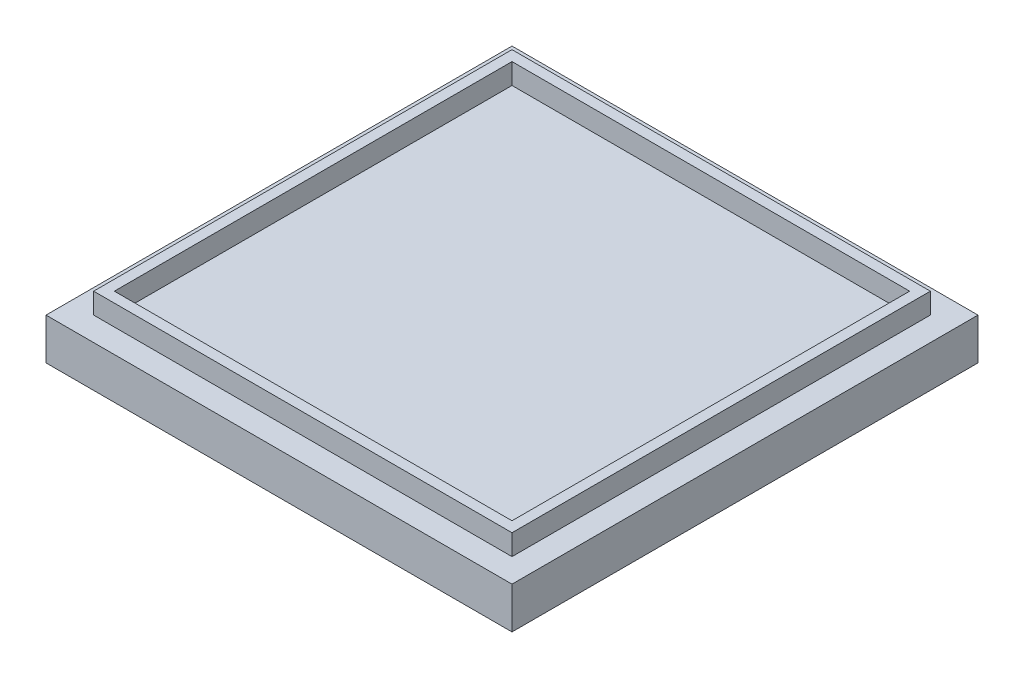
from build123d import *

# Parameters (mm, degrees)
SKETCH1_W           = 225
SKETCH1_H           = 225
BOSS_EXTRUDE1_DEPTH = 20
SKETCH2_W           = 202
SKETCH2_H           = 202
SKETCH2_W_2         = 192
SKETCH2_H_2         = 192
BOSS_EXTRUDE2_DEPTH = 10


with BuildPart() as part:
    # Sketch1 → Boss-Extrude1 (new body)
    with BuildSketch(Plane(origin=(0, 0, 0), x_dir=(1, 0, 0), z_dir=(0, 1, 0))):
        Rectangle(SKETCH1_W, SKETCH1_H)
    extrude(amount=BOSS_EXTRUDE1_DEPTH)

    # Sketch2 → Boss-Extrude2 (add)
    with BuildSketch(Plane(origin=(0, 20, 0), x_dir=(1, 0, 0), z_dir=(0, 1, 0))):
        Rectangle(SKETCH2_W, SKETCH2_H)
        Rectangle(SKETCH2_W_2, SKETCH2_H_2, mode=Mode.SUBTRACT)
    extrude(amount=BOSS_EXTRUDE2_DEPTH)


solid = part.part
